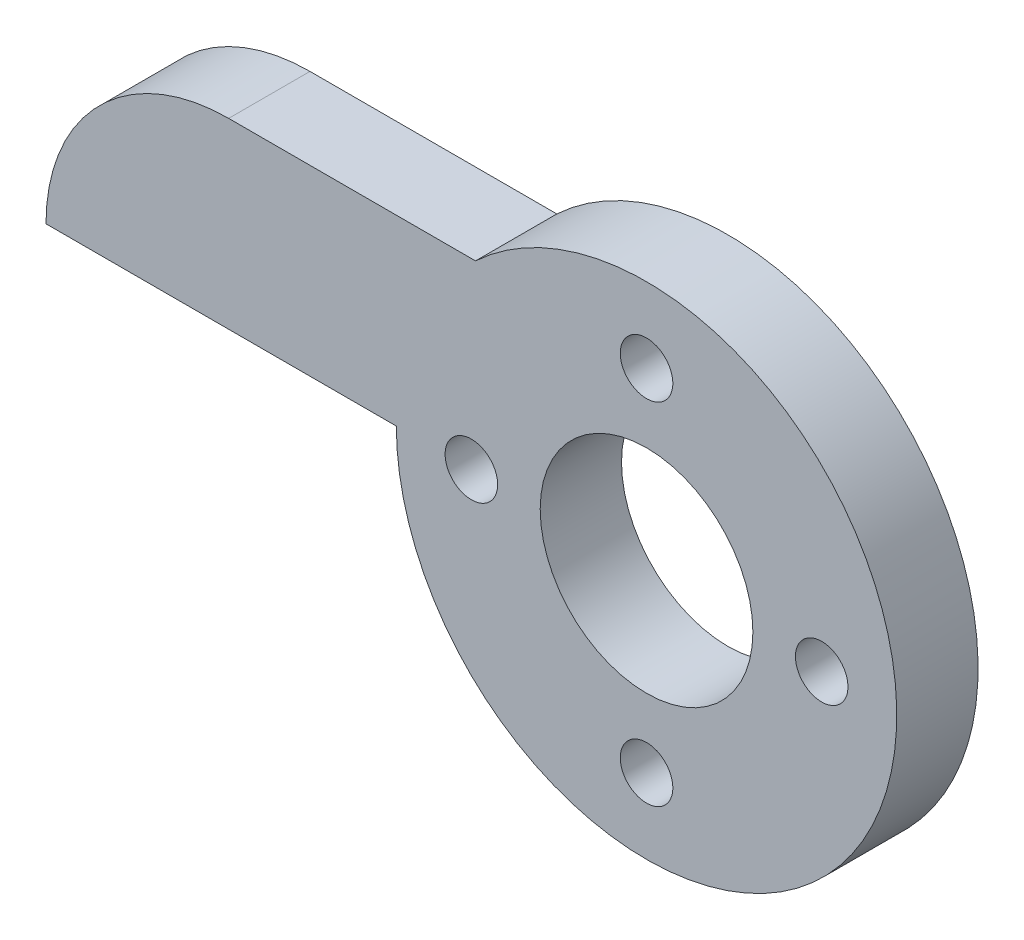
from build123d import *

# Parameters (mm, degrees)
SKETCH2_R           = 10
SKETCH2_R_2         = 1.05
SKETCH2_R_3         = 4.25
BOSS_EXTRUDE2_DEPTH = 3.25


with BuildPart() as part:
    # Sketch2 → Boss-Extrude2 (new body)
    # profile 1 of 2: a face of its own
    with BuildSketch(Plane.XY):
        with BuildLine():
            Line((-24, 0), (-10, 0))
            ThreePointArc((-10, 0), (-9.17454943, 3.978397008), (-6.83447145, 7.3))
            Line((-6.83447145, 7.3), (-16.7, 7.3))
            ThreePointArc((-16.7, 7.3), (-21.861879503, 5.161879503), (-24, 0))
        make_face()
    # profile 2 of 2: a face of its own
    with BuildSketch(Plane.XY):
        Circle(SKETCH2_R)
        with Locations(Location((0, -7, 0), (0, 0, 180))):
            Circle(SKETCH2_R_2, mode=Mode.SUBTRACT)
        with Locations(Location((-7, 0, 0), (0, 0, 180))):
            Circle(SKETCH2_R_2, mode=Mode.SUBTRACT)
        with Locations(Location((0, 7, 0), (0, 0, 180))):
            Circle(SKETCH2_R_2, mode=Mode.SUBTRACT)
        with Locations(Location((7, 0, 0), (0, 0, 180))):
            Circle(SKETCH2_R_2, mode=Mode.SUBTRACT)
        with Locations(Location((0, 0, 0), (0, 0, 180))):
            Circle(SKETCH2_R_3, mode=Mode.SUBTRACT)
    extrude(amount=BOSS_EXTRUDE2_DEPTH)


solid = part.part
